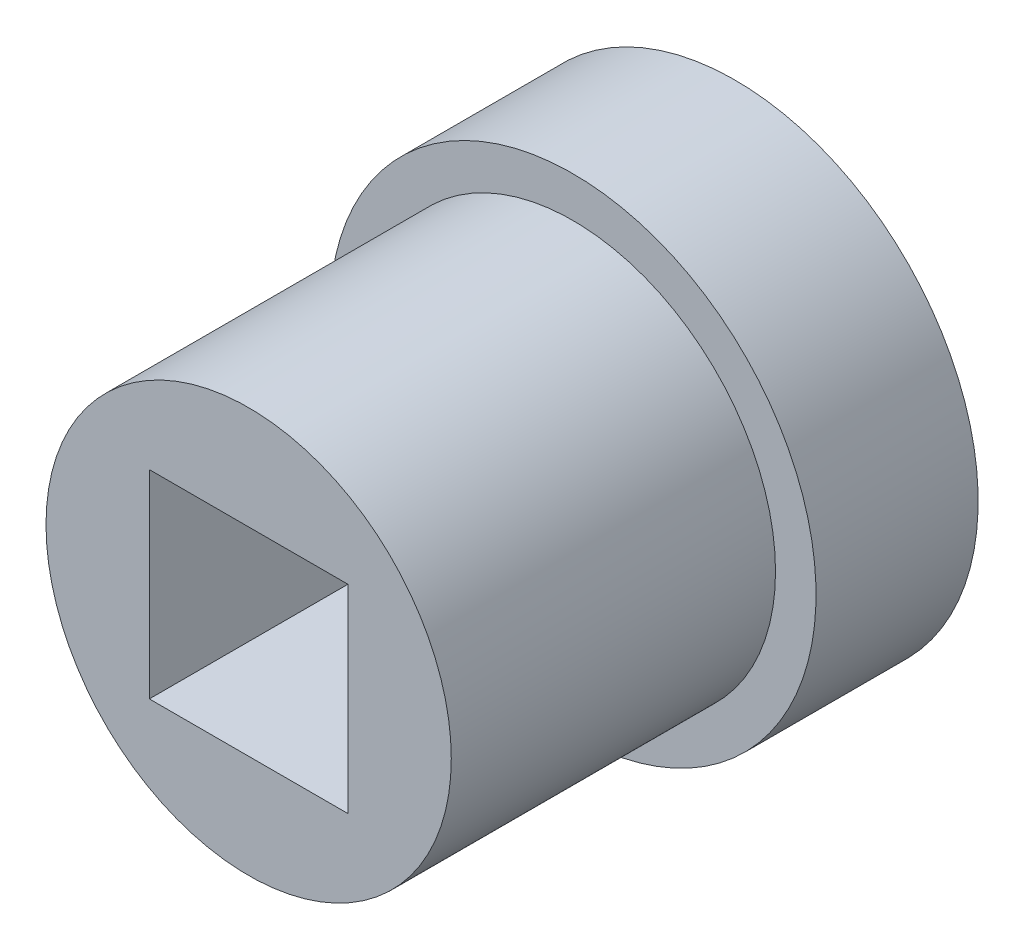
from build123d import *

# Parameters (mm, degrees)
SKETCH1_R           = 12.5
BOSS_EXTRUDE1_DEPTH = 10
SKETCH11_R          = 15
BOSS_EXTRUDE2_DEPTH = 10
SKETCH8_W           = 12.25
SKETCH8_H           = 12.25
CUT_EXTRUDE1_DEPTH  = 37.742346142
SKETCH12_R          = 1
CUT_EXTRUDE2_DEPTH  = 5
CIRPATTERN1_COUNT   = 7


with BuildPart() as part:
    # Sketch1 → Boss-Extrude1 (new, symmetric)
    with BuildSketch(Plane.XY):
        Circle(SKETCH1_R)
    extrude(amount=BOSS_EXTRUDE1_DEPTH, both=True)

    # Sketch11 → Boss-Extrude2 (add)
    with BuildSketch(Plane(origin=(0, 0, -10), x_dir=(-1, 0, 0), z_dir=(0, 0, -1))):
        Circle(SKETCH11_R)
    extrude(amount=BOSS_EXTRUDE2_DEPTH)

    # Sketch8 → Cut-Extrude1 (cut, through all)
    with BuildSketch(Plane.XY.offset(10)):
        Rectangle(SKETCH8_W, SKETCH8_H)
    extrude(amount=-CUT_EXTRUDE1_DEPTH, mode=Mode.SUBTRACT)

    # Sketch12 → Cut-Extrude2 (cut)
    with BuildSketch(Plane(origin=(0, 0, -20), x_dir=(-1, 0, 0), z_dir=(0, 0, -1))):
        with Locations((0, 12.00000002)):
            Circle(SKETCH12_R)
    cut_extrude2 = extrude(amount=-CUT_EXTRUDE2_DEPTH, mode=Mode.SUBTRACT)

    # CirPattern1: Cut-Extrude2 ×7 about axis
    cirpattern1_axis = Axis((0, 0, 0), (0, 0, 1))
    for i in range(1, CIRPATTERN1_COUNT):
        add(cut_extrude2.rotate(cirpattern1_axis, i * 360 / CIRPATTERN1_COUNT), mode=Mode.SUBTRACT)


solid = part.part
